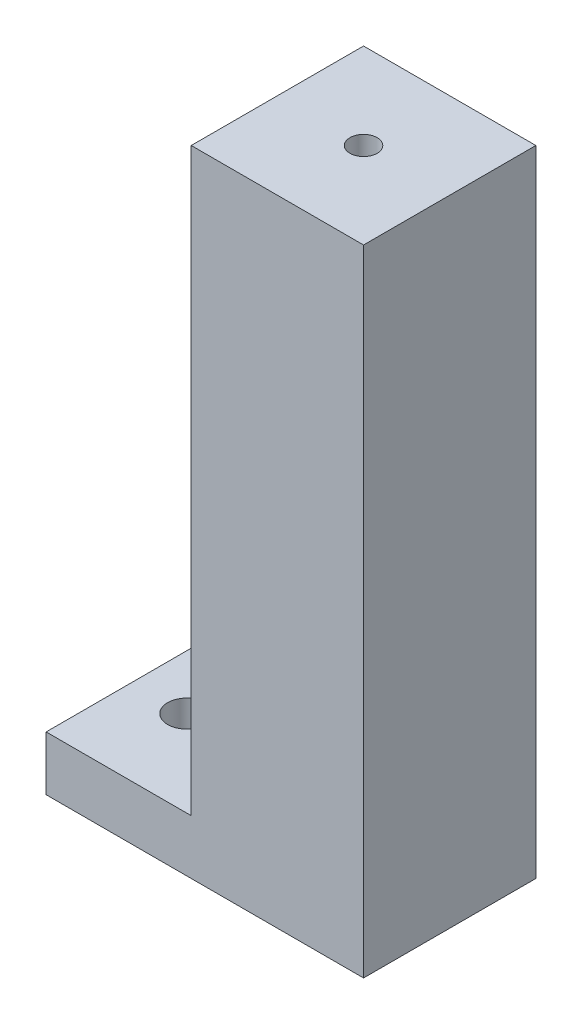
from build123d import *

# Parameters (mm, degrees)
SKETCH_1_W          = 35
SKETCH_1_H          = 19
SKETCH_1_R          = 2.1
EXTRUDE_1_DEPTH     = 6
SKETCH_2_W          = 19
SKETCH_2_H          = 19
EXTRUDE_2_DEPTH     = 64
SKETCH_4_R          = 1.5
CUT_EXTRUDE_1_DEPTH = 10


with BuildPart() as part:
    # 草图1 → 凸台-拉伸1 (new body)
    with BuildSketch(Plane(origin=(0, 0, 0), x_dir=(1, 0, 0), z_dir=(0, 1, 0))):
        Rectangle(SKETCH_1_W, SKETCH_1_H)
        with Locations(Location((-11.5, 0, 0), (0, 0, 270))):
            Circle(SKETCH_1_R, mode=Mode.SUBTRACT)
    extrude(amount=EXTRUDE_1_DEPTH)

    # 草图2 → 凸台-拉伸2 (add)
    with BuildSketch(Plane(origin=(0, 6, 0), x_dir=(1, 0, 0), z_dir=(0, 1, 0))):
        with Locations((8, 0)):
            Rectangle(SKETCH_2_W, SKETCH_2_H)
    extrude(amount=EXTRUDE_2_DEPTH)

    # 草图4 → 切除-拉伸1 (cut)
    with BuildSketch(Plane(origin=(0, 70, 0), x_dir=(1, 0, 0), z_dir=(0, 1, 0))):
        with Locations(Location((8, 0, 0), (0, 0, 270))):
            Circle(SKETCH_4_R)
    extrude(amount=-CUT_EXTRUDE_1_DEPTH, mode=Mode.SUBTRACT)


solid = part.part
